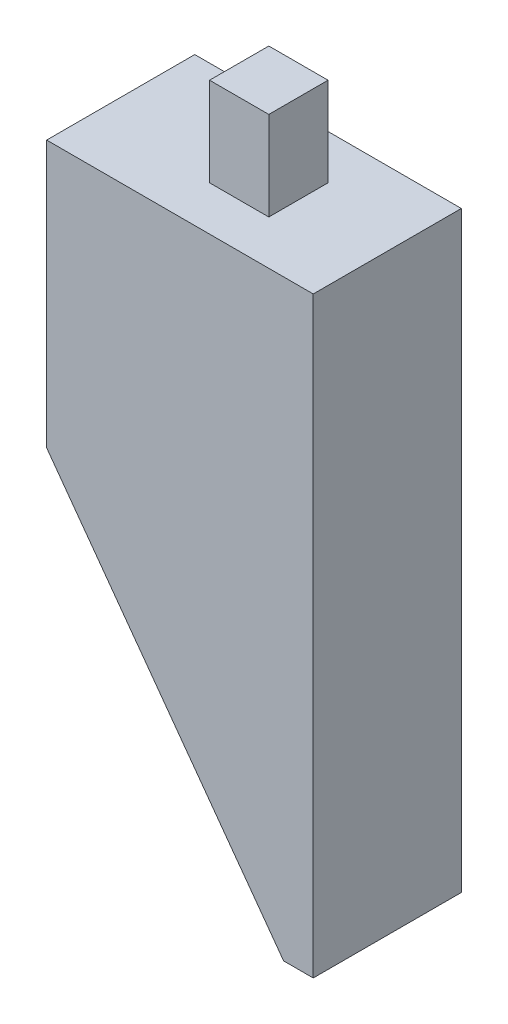
from build123d import *

# Parameters (mm, degrees)
SALIENTE_EXTRUIR3_DEPTH = 50
CROQUIS3_W              = 20
CROQUIS3_H              = 20
SALIENTE_EXTRUIR4_DEPTH = 30


with BuildPart() as part:
    # Croquis2 → Saliente-Extruir3 (new body)
    with BuildSketch(Plane.XY):
        Polygon((0, 200), (0, 110), (80, 0), (90, 0), (90, 200), align=None)
    extrude(amount=SALIENTE_EXTRUIR3_DEPTH)

    # Croquis3 → Saliente-Extruir4 (add)
    with BuildSketch(Plane(origin=(0, 200, 0), x_dir=(1, 0, 0), z_dir=(0, 1, 0))):
        with Locations((50, -25)):
            Rectangle(CROQUIS3_W, CROQUIS3_H)
    extrude(amount=SALIENTE_EXTRUIR4_DEPTH)


solid = part.part
